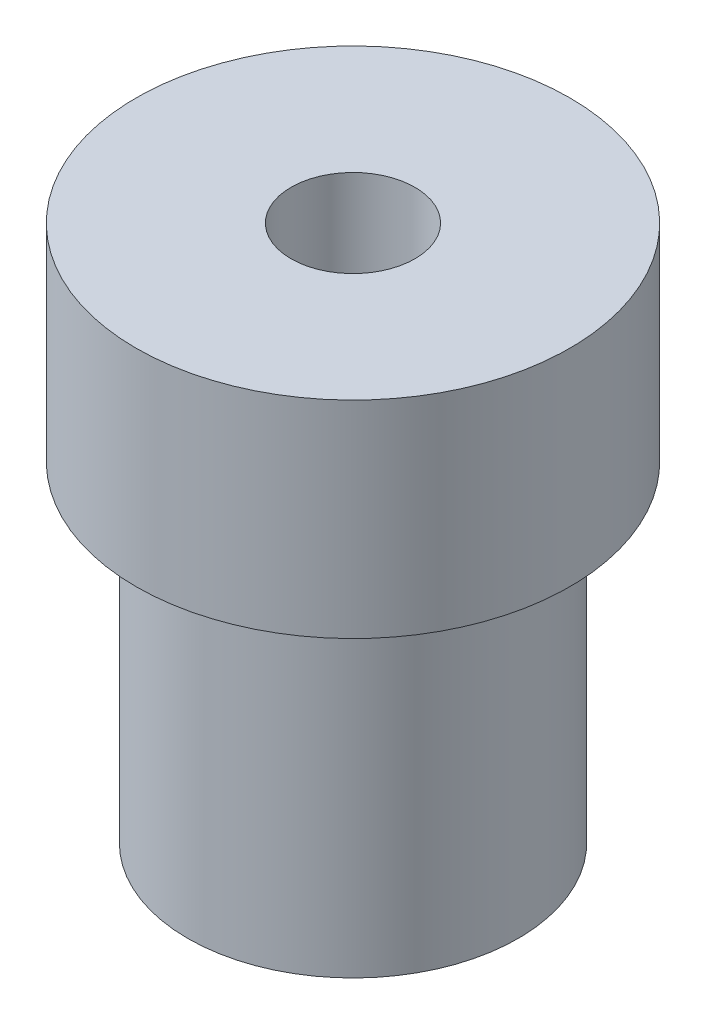
from build123d import *

# Parameters (mm, degrees)
SKETCH1_R               = 10.5
BOSS_EXTRUDE1_DEPTH     = 10
SKETCH2_R               = 8
BOSS_EXTRUDE2_DEPTH     = 16
CUT_EXTRUDE1_DEPTH      = 22.828879953
CUT_EXTRUDE1_DEPTH_BACK = 22.828879953
SKETCH3_R               = 3


with BuildPart() as part:
    # Sketch1 → Boss-Extrude1 (new body)
    with BuildSketch(Plane(origin=(0, 0, 0), x_dir=(1, 0, 0), z_dir=(0, 1, 0))):
        with Locations(Location((0, 0, 0), (0, 0, 270))):
            Circle(SKETCH1_R)
    extrude(amount=BOSS_EXTRUDE1_DEPTH)

    # Sketch2 → Boss-Extrude2 (add)
    with BuildSketch(Plane(origin=(0, 0, 0), x_dir=(1, 0, 0), z_dir=(0, 1, 0))):
        with Locations(Location((0, 0, 0), (0, 0, 270))):
            Circle(SKETCH2_R)
    extrude(amount=-BOSS_EXTRUDE2_DEPTH)

    # Sketch3 → Cut-Extrude1 (cut, two sides: drawn at the far end of the back side and taken through both)
    with BuildSketch(Plane(origin=(0, 0, 0), x_dir=(1, 0, 0), z_dir=(0, 1, 0)).offset(-CUT_EXTRUDE1_DEPTH_BACK)):
        with Locations(Location((0, 0, 0), (0, 0, 270))):
            Circle(SKETCH3_R)
    extrude(amount=CUT_EXTRUDE1_DEPTH + CUT_EXTRUDE1_DEPTH_BACK, mode=Mode.SUBTRACT)


solid = part.part
